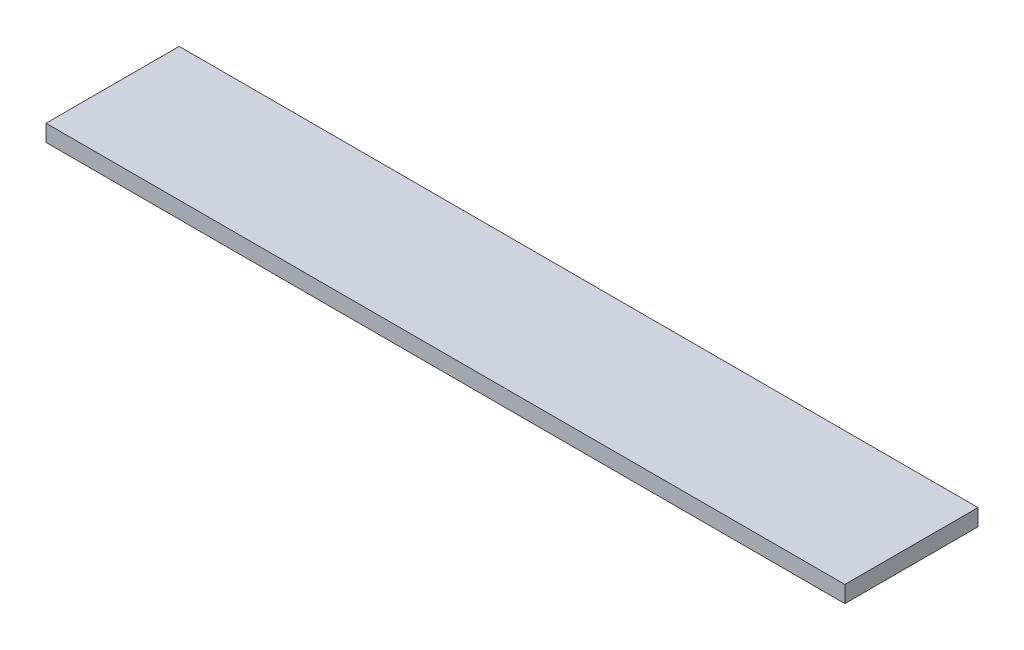
from build123d import *

# Parameters (mm, degrees)
SKETCH1_W           = 152.4
SKETCH1_H           = 25.4
BOSS_EXTRUDE1_DEPTH = 3.175


with BuildPart() as part:
    # Sketch1 → Boss-Extrude1 (new body)
    with BuildSketch(Plane(origin=(0, 0, 0), x_dir=(1, 0, 0), z_dir=(0, 1, 0))):
        Rectangle(SKETCH1_W, SKETCH1_H)
    extrude(amount=BOSS_EXTRUDE1_DEPTH)


solid = part.part
